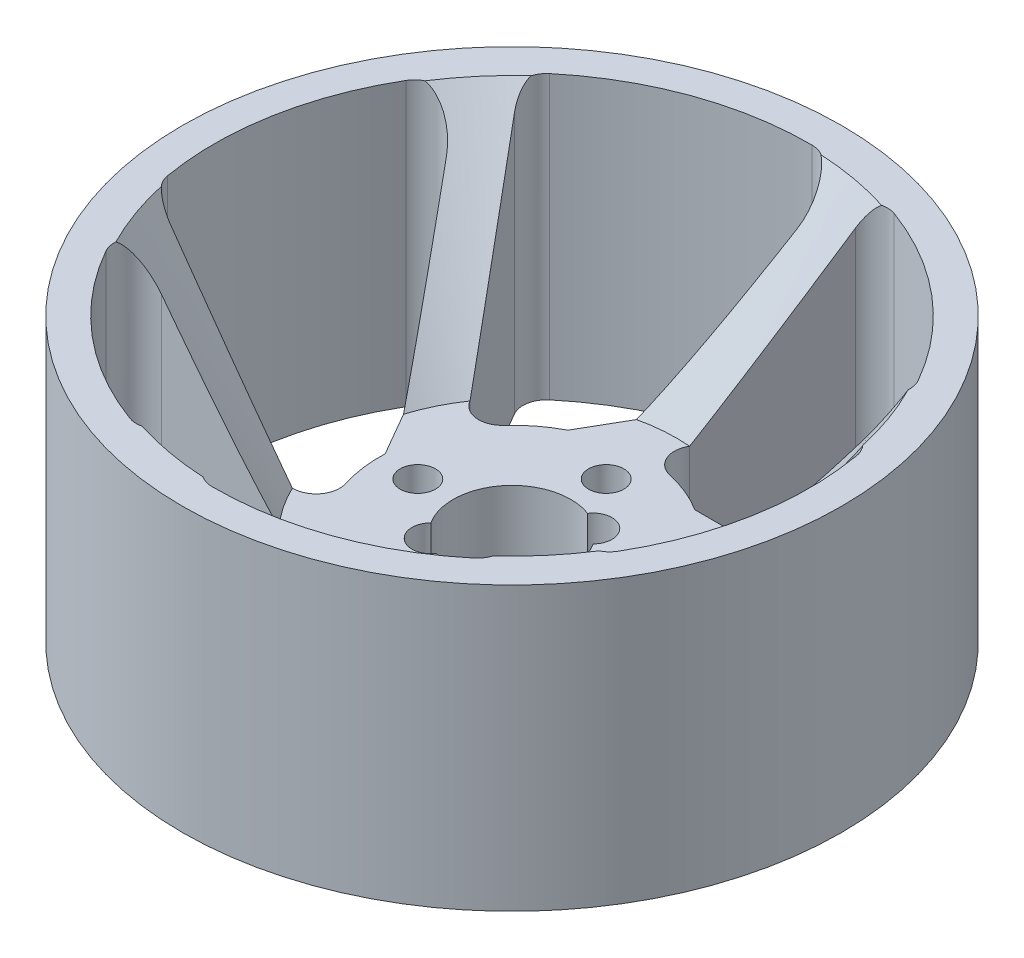
from build123d import *

# Parameters (mm, degrees)
SKETCH1_R           = 28
BOSS_EXTRUDE1_DEPTH = 24
SKETCH6_R           = 1.9
CUT_EXTRUDE6_DEPTH  = 24
CUT_EXTRUDE7_DEPTH  = 24
CIRPATTERN1_COUNT   = 6
SKETCH17_R          = 1.5
CUT_EXTRUDE9_DEPTH  = 8
SKETCH18_R          = 1.607527434
CUT_EXTRUDE10_DEPTH = 8


with BuildPart() as part:
    # Sketch1 → Boss-Extrude1 (new body)
    with BuildSketch(Plane(origin=(0, 0, 0), x_dir=(1, 0, 0), z_dir=(0, 1, 0))):
        with Locations(Location((0, 0, 0), (0, 0, 270))):
            Circle(SKETCH1_R)
    extrude(amount=BOSS_EXTRUDE1_DEPTH)

    # Sketch6 → Cut-Extrude6 (cut)
    with BuildSketch(Plane(origin=(0, 0, 0), x_dir=(1, 0, 0), z_dir=(0, 1, 0))):
        with Locations(Location((0, 0, 0), (0, 0, 270))):
            Circle(SKETCH6_R)
    extrude(amount=CUT_EXTRUDE6_DEPTH, mode=Mode.SUBTRACT)

    # Sketch3 → Cut-Extrude7 (cut)
    with BuildSketch(Plane(origin=(0, 0, 0), x_dir=(1, 0, 0), z_dir=(0, 1, 0))):
        with BuildLine():
            Line((6.025985397, 9.5), (20.264254242, 9.5))
            ThreePointArc((20.264254242, 9.5), (21.992584206, 10.493582822), (22.003675207, 12.487124464))
            ThreePointArc((22.003675207, 12.487124464), (16.353652552, 19.304094079), (8.700746754, 23.756830721))
            ThreePointArc((8.700746754, 23.756830721), (7.330784322, 23.758890252), (6.280889879, 22.878820388))
            Line((6.280889879, 22.878820388), (1.119750126, 13.939464109))
            ThreePointArc((1.119750126, 13.939464109), (1.021677147, 12.132837227), (2.421340415, 10.986337451))
            ThreePointArc((2.421340415, 10.986337451), (4.288546152, 10.400522675), (6.025985397, 9.5))
        make_face()
    cut_extrude7 = extrude(amount=CUT_EXTRUDE7_DEPTH, mode=Mode.SUBTRACT)

    # CirPattern1: Cut-Extrude7 ×6 about axis
    cirpattern1_axis = Axis((0, 0, 0), (0, 1, 0))
    for i in range(1, CIRPATTERN1_COUNT):
        add(cut_extrude7.rotate(cirpattern1_axis, i * 360 / CIRPATTERN1_COUNT), mode=Mode.SUBTRACT)

    # Sketch14 → Revolve1 (revolve)
    with BuildSketch(Plane.XY):
        Polygon((25.5, 13), (25.5, 12), (28, 12), (28, 14), align=None)
    revolve1 = revolve(axis=Axis((0, 24, 0), (0, -1, 0)))

    # Mirror11: Revolve1 across plane
    add(revolve1.mirror(Plane.ZX.offset(12)))

    # Sketch15 → Cut-Revolve5 (revolve, cut)
    with BuildSketch(Plane.XY, mode=Mode.PRIVATE) as cut_revolve5_sk:
        Polygon((5, 8), (5, 0), (0, 0), (0, 8), (0, 24), (25, 24), (14, 8), align=None)
    revolve(cut_revolve5_sk.sketch.rotate(Axis((0, 8, 0), (0, -1, 0)), 90), axis=Axis((0, 8, 0), (0, -1, 0)), mode=Mode.SUBTRACT)

    # Sketch17 → Cut-Extrude9 (cut)
    with BuildSketch(Plane(origin=(0, 0, 0), x_dir=(1, 0, 0), z_dir=(0, 1, 0))):
        with Locations(Location((0, 8, 0), (0, 0, 270))):
            Circle(SKETCH17_R)
        with Locations(Location((8, 0, 0), (0, 0, 270))):
            Circle(SKETCH17_R)
        with Locations(Location((0, -8, 0), (0, 0, 270))):
            Circle(SKETCH17_R)
        with Locations(Location((-8, 0, 0), (0, 0, 270))):
            Circle(SKETCH17_R)
    extrude(amount=CUT_EXTRUDE9_DEPTH, mode=Mode.SUBTRACT)

    # Sketch18 → Cut-Extrude10 (cut)
    with BuildSketch(Plane(origin=(0, 0, 0), x_dir=(1, 0, 0), z_dir=(0, 1, 0))):
        with Locations((3.080772614, 3.800674665)):
            Circle(SKETCH18_R)
        with Locations((-3.080772614, -3.800674665)):
            Circle(SKETCH18_R)
    extrude(amount=CUT_EXTRUDE10_DEPTH, mode=Mode.SUBTRACT)


solid = part.part
